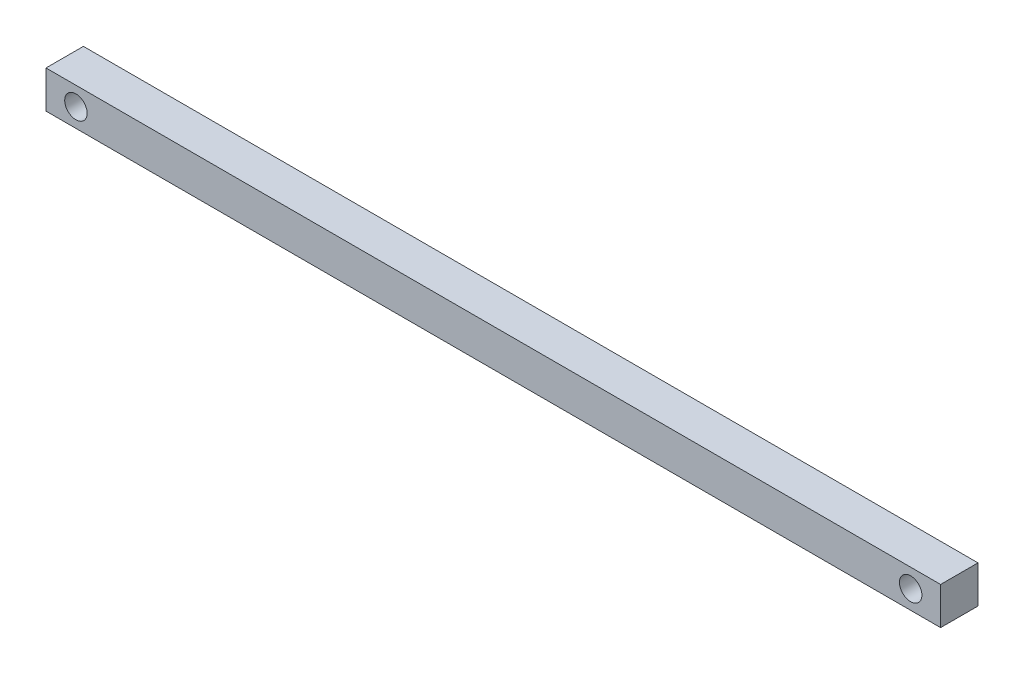
from build123d import *

# Parameters (mm, degrees)
SKETCH1_W               = 598
SKETCH1_H               = 25
BOSS_EXTRUDE1_DEPTH     = 25
CUT_EXTRUDE1_DEPTH      = 301.303596382
CUT_EXTRUDE1_DEPTH_BACK = 301.303596382
SKETCH2_R               = 7.5


with BuildPart() as part:
    # Sketch1 → Boss-Extrude1 (new body)
    with BuildSketch(Plane.XY):
        Rectangle(SKETCH1_W, SKETCH1_H)
    extrude(amount=BOSS_EXTRUDE1_DEPTH)

    # Sketch2 → Cut-Extrude1 (cut, two sides: drawn at the far end of the back side and taken through both)
    with BuildSketch(Plane.XY.offset(25).offset(-CUT_EXTRUDE1_DEPTH_BACK)):
        with Locations((-279, 0)):
            Circle(SKETCH2_R)
        with Locations((279, 0)):
            Circle(SKETCH2_R)
    extrude(amount=CUT_EXTRUDE1_DEPTH + CUT_EXTRUDE1_DEPTH_BACK, mode=Mode.SUBTRACT)


solid = part.part
